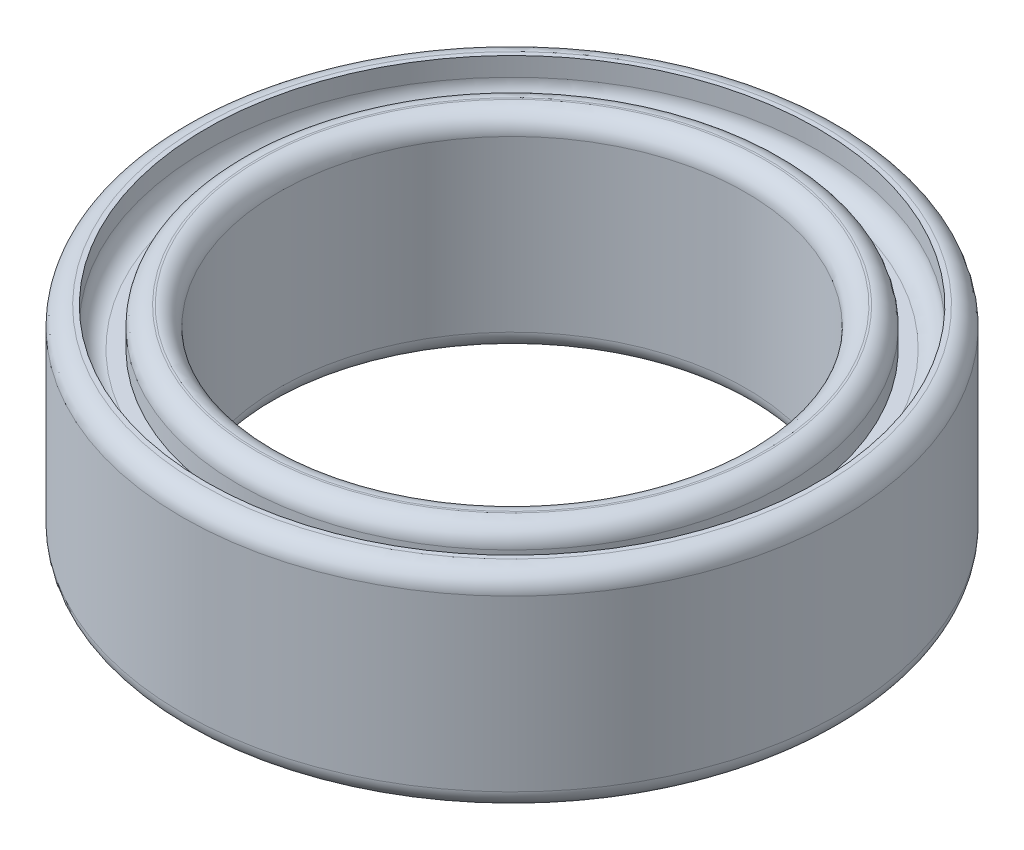
from build123d import *

# Parameters (mm, degrees)
SKETCH1_R           = 17.5
SKETCH1_R_2         = 12.4
BOSS_EXTRUDE1_DEPTH = 11
FILLET3_R           = 1
SKETCH2_R           = 16.25
SKETCH2_R_2         = 14.5
CUT_EXTRUDE3_DEPTH  = 2
CUT_EXTRUDE4_START  = -2
SKETCH4_R           = 16.25
SKETCH4_R_2         = 14.5
CUT_EXTRUDE4_DEPTH  = 2
FILLET4_R           = 1
FILLET5_R           = 1


with BuildPart() as part:
    # Sketch1 → Boss-Extrude1 (new body)
    with BuildSketch(Plane(origin=(0, 0, 0), x_dir=(1, 0, 0), z_dir=(0, 1, 0))):
        with Locations(Location((0, 0, 0), (0, 0, 270))):
            Circle(SKETCH1_R)
        with Locations(Location((0, 0, 0), (0, 0, 270))):
            Circle(SKETCH1_R_2, mode=Mode.SUBTRACT)
    extrude(amount=BOSS_EXTRUDE1_DEPTH)

    # Fillet3
    fillet3_edges = [part.edges().sort_by_distance(p)[0] for p in [
        (0, 0, -12.4),
        (0, 11, -12.4),
    ]]
    fillet(fillet3_edges, radius=FILLET3_R)

    # Sketch2 → Cut-Extrude3 (cut)
    with BuildSketch(Plane(origin=(0, 11, 0), x_dir=(1, 0, 0), z_dir=(0, 1, 0))):
        with Locations(Location((0, 0, 0), (0, 0, 270))):
            Circle(SKETCH2_R)
        with Locations(Location((0, 0, 0), (0, 0, 270))):
            Circle(SKETCH2_R_2, mode=Mode.SUBTRACT)
    extrude(amount=-CUT_EXTRUDE3_DEPTH, mode=Mode.SUBTRACT)

    # Sketch4 → Cut-Extrude4 (cut)
    with BuildSketch(Plane.XZ.offset(CUT_EXTRUDE4_START)):
        with Locations(Location((0, 0, 0), (0, 0, 90))):
            Circle(SKETCH4_R)
        with Locations(Location((0, 0, 0), (0, 0, 90))):
            Circle(SKETCH4_R_2, mode=Mode.SUBTRACT)
    extrude(amount=CUT_EXTRUDE4_DEPTH, mode=Mode.SUBTRACT)

    # Fillet4
    fillet4_edges = [part.edges().sort_by_distance(p)[0] for p in [
        (0, 11, -14.5),
        (0, 0, -17.5),
        (0, 0, -14.5),
        (0, 11, -17.5),
    ]]
    fillet(fillet4_edges, radius=FILLET4_R)

    # Fillet5
    fillet5_edges = [part.edges().sort_by_distance(p)[0] for p in [
        (0, 9, -16.25),
        (0, 2, -16.25),
    ]]
    fillet(fillet5_edges, radius=FILLET5_R)


solid = part.part
